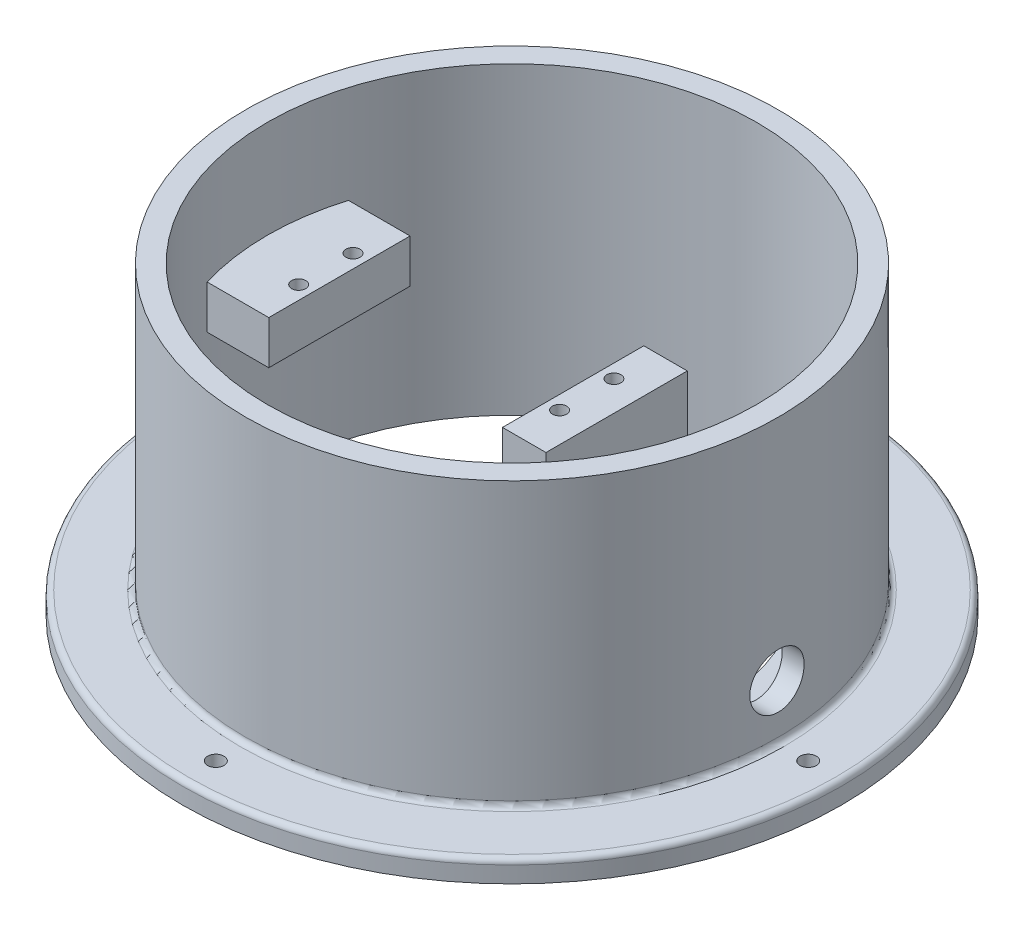
from build123d import *

# Parameters (mm, degrees)
SKETCH1_R           = 60.625
SKETCH1_R_2         = 45
BOSS_EXTRUDE1_DEPTH = 4
SKETCH2_R           = 49
SKETCH2_R_2         = 45
BOSS_EXTRUDE2_DEPTH = 52
SKETCH3_W           = 8
SKETCH3_H           = 38
SKETCH3_W_2         = 15
SKETCH3_H_2         = 8
BOSS_EXTRUDE3_DEPTH = 13
SKETCH4_W           = 10
SKETCH4_H           = 24
CUT_EXTRUDE1_DEPTH  = 8
SKETCH5_R           = 5
CUT_EXTRUDE2_DEPTH  = 110.441337026
SKETCH6_R           = 1.3
CUT_EXTRUDE3_DEPTH  = 7.2
BOSS_EXTRUDE4_DEPTH = 4
SKETCH8_R           = 1.5
CUT_EXTRUDE4_DEPTH  = 103.404986506
FILLET1_R           = 1


with BuildPart() as part:
    # Sketch1 → Boss-Extrude1 (new body)
    with BuildSketch(Plane(origin=(0, 0, 0), x_dir=(1, 0, 0), z_dir=(0, 1, 0))):
        with Locations(Location((0, 0, 0), (0, 0, 270))):
            Circle(SKETCH1_R)
        with Locations(Location((0, 0, 0), (0, 0, 270))):
            Circle(SKETCH1_R_2, mode=Mode.SUBTRACT)
    extrude(amount=BOSS_EXTRUDE1_DEPTH)

    # Sketch2 → Boss-Extrude2 (add)
    with BuildSketch(Plane(origin=(0, 4, 0), x_dir=(1, 0, 0), z_dir=(0, 1, 0))):
        with Locations(Location((0, 0, 0), (0, 0, 90))):
            Circle(SKETCH2_R)
        with Locations(Location((0, 0, 0), (0, 0, 270))):
            Circle(SKETCH2_R_2, mode=Mode.SUBTRACT)
    extrude(amount=BOSS_EXTRUDE2_DEPTH)

    # Sketch3 → Boss-Extrude3 (add, symmetric)
    with BuildSketch(Plane.XY):
        with Locations((15.25, 23)):
            Rectangle(SKETCH3_W, SKETCH3_H)
        with Locations((-39.25, 34)):
            Rectangle(SKETCH3_W_2, SKETCH3_H_2)
    extrude(amount=BOSS_EXTRUDE3_DEPTH, both=True)


with BuildPart() as boss_extrude3_piece_1:
    # of the separate pieces the step leaves, piece 1, a body of its own (boss_extrude3_pieces)
    add(part.part.solids().sort_by_distance((0, 0, 60.625))[0])

    # Sketch5 → Cut-Extrude2 (cut, through all)
    with BuildSketch(Plane.ZY.offset(-11.25)):
        with Locations((0, 14)):
            Circle(SKETCH5_R)
    extrude(amount=-CUT_EXTRUDE2_DEPTH, mode=Mode.SUBTRACT)


with BuildPart() as boss_extrude3_piece_2:
    # of the separate pieces the step leaves, piece 2, a body of its own (boss_extrude3_pieces)
    add(part.part.solids().sort_by_distance((19.25, 4, -13))[0])

    # Sketch4 → Cut-Extrude1 (cut)
    with BuildSketch(Plane.ZY.offset(-11.25)):
        with Locations((0, 17)):
            Rectangle(SKETCH4_W, SKETCH4_H)
    extrude(amount=-CUT_EXTRUDE1_DEPTH, mode=Mode.SUBTRACT)


with BuildPart() as cut_extrude3_tool:
    # Sketch6 → Cut-Extrude3 (new body)
    with BuildSketch(Plane(origin=(0, 42, 0), x_dir=(1, 0, 0), z_dir=(0, 1, 0))):
        with Locations(Location((-34.25, 5, 0), (0, 0, 270))):
            Circle(SKETCH6_R)
        with Locations(Location((-34.25, -5, 0), (0, 0, 270))):
            Circle(SKETCH6_R)
        with Locations(Location((13.75, -5, 0), (0, 0, 270))):
            Circle(SKETCH6_R)
        with Locations(Location((13.75, 5, 0), (0, 0, 270))):
            Circle(SKETCH6_R)
    extrude(amount=-CUT_EXTRUDE3_DEPTH)


with BuildPart() as boss_extrude3_piece_1_1:
    add(boss_extrude3_piece_1.part)

    # Cut-Extrude3: cut by cut_extrude3_tool
    add(cut_extrude3_tool.part, mode=Mode.SUBTRACT)

    # Sketch8 → Cut-Extrude4 (cut, through all)
    with BuildSketch(Plane.XZ):
        with Locations(Location((54.5, 0, 0), (0, 0, 270))):
            Circle(SKETCH8_R)
        with Locations(Location((0, -54.5, 0), (0, 0, 270))):
            Circle(SKETCH8_R)
        with Locations(Location((-54.5, 0, 0), (0, 0, 270))):
            Circle(SKETCH8_R)
        with Locations(Location((0, 54.5, 0), (0, 0, 270))):
            Circle(SKETCH8_R)
    extrude(amount=-CUT_EXTRUDE4_DEPTH, mode=Mode.SUBTRACT)

    # Fillet1
    fillet1_edges = [boss_extrude3_piece_1_1.edges().sort_by_distance(p)[0] for p in [
        (0, 4, 49),
        (0, 4, -60.625),
    ]]
    fillet(fillet1_edges, radius=FILLET1_R)


with BuildPart() as boss_extrude3_piece_2_1:
    add(boss_extrude3_piece_2.part)

    # Cut-Extrude3: cut by cut_extrude3_tool
    add(cut_extrude3_tool.part, mode=Mode.SUBTRACT)


with BuildPart() as body_3:
    # Sketch7 → Boss-Extrude4 (new body)
    with BuildSketch(Plane.XZ):
        with BuildLine():
            Line((11.25, 13), (25.249838503, 37.248431585))
            ThreePointArc((25.249838503, 37.248431585), (45, 0), (25.249838503, -37.248431585))
            Line((25.249838503, -37.248431585), (11.25, -13))
            Line((11.25, -13), (11.25, 13))
        make_face()
        with BuildLine():
            Line((24.25, 19.516660498), (27.361802413, 24.906460381))
            ThreePointArc((27.361802413, 24.906460381), (37, 0), (27.361802413, -24.906460381))
            Line((27.361802413, -24.906460381), (24.25, -19.516660498))
            Line((24.25, -19.516660498), (24.25, 19.516660498))
        make_face(mode=Mode.SUBTRACT)
    extrude(amount=-BOSS_EXTRUDE4_DEPTH)


solid = Compound([boss_extrude3_piece_1_1.part, boss_extrude3_piece_2_1.part, body_3.part])
